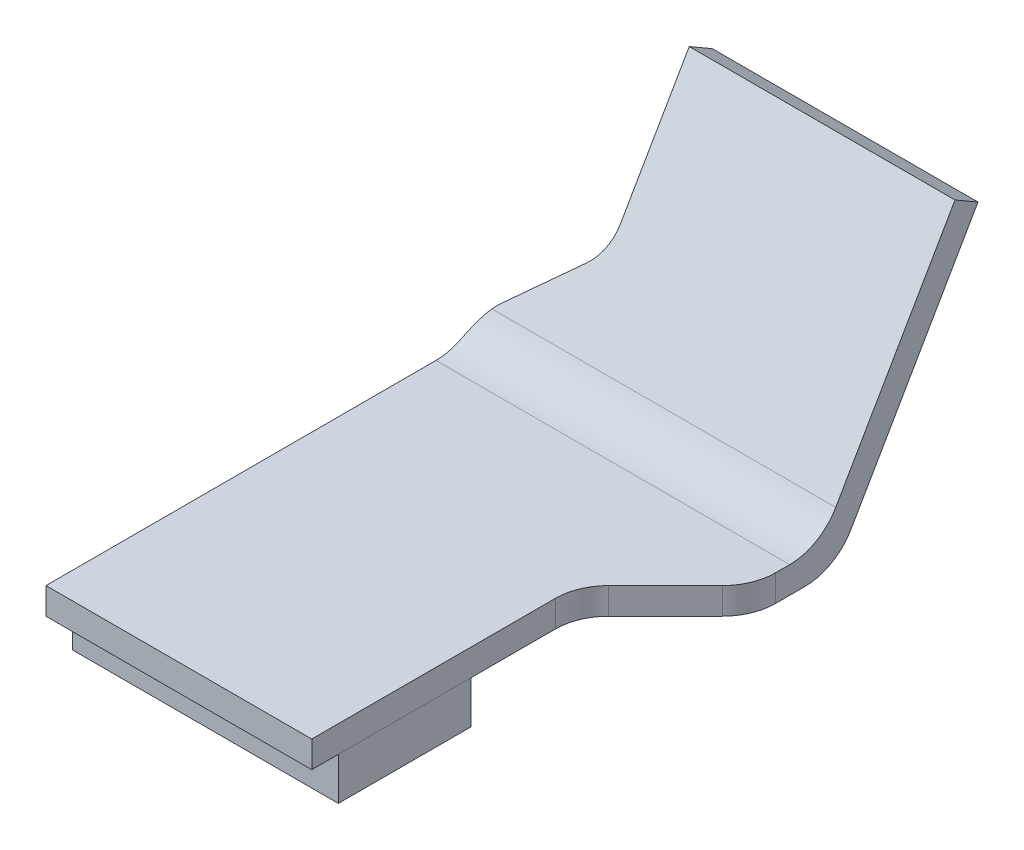
from build123d import *

# Parameters (mm, degrees)
BOSS_EXTRUDE1_DEPTH = 13.31
CUT_EXTRUDE1_DEPTH  = 1
CUT_EXTRUDE2_DEPTH  = 1
FILLET1_R           = 2
FILLET2_R           = 2
SKETCH4_W           = 10
SKETCH4_H           = 5
BOSS_EXTRUDE2_DEPTH = 1.6


with BuildPart() as part:
    # Sketch1 → Boss-Extrude1 (new body)
    with BuildSketch(Plane(origin=(0, 0, 0), x_dir=(0, 0, -1), z_dir=(1, 0, 0))):
        Polygon((4.487924596, 9.773313421), (-0.577350269, 1), (-16.4065524, 1), (-16.4065524, 0), (0, 0), (5.35395, 9.273313421), align=None)
    extrude(amount=BOSS_EXTRUDE1_DEPTH)

    # Sketch2 → Cut-Extrude1 (cut)
    with BuildSketch(Plane(origin=(0, 0, 0), x_dir=(1, 0, 0), z_dir=(0, 1, 0))):
        Polygon((13.31, -16.4065524), (10, -16.4065524), (10, -6.4065524), (13.31, -3.0965524), align=None)
    extrude(amount=CUT_EXTRUDE1_DEPTH, mode=Mode.SUBTRACT)

    # Sketch3 → Cut-Extrude2 (cut)
    with BuildSketch(Plane(origin=(0, 0.49999999999999784, 0.8660254037844414), x_dir=(1, 0, 0), z_dir=(0, 0.49999999999999734, 0.8660254037844402))):
        Polygon((0, 10.7079), (0, 1.3979), (3.31, 4.7079), (3.31, 10.7079), align=None)
    extrude(amount=-CUT_EXTRUDE2_DEPTH, mode=Mode.SUBTRACT)

    # Fillet1
    fillet1_edges = [part.edges().sort_by_distance(p)[0] for p in [
        (6.655, 1, 0.577350269),
        (6.655, 0, 0),
    ]]
    fillet(fillet1_edges, radius=FILLET1_R)

    # Fillet2
    fillet2_edges = [part.edges().sort_by_distance(p)[0] for p in [
        (3.31, 4.327160998, -1.920937298),
        (0, 1.467644852, -0.25376455),
        (10, 0.5, 6.4065524),
        (13.31, 0.5, 3.0965524),
    ]]
    fillet(fillet2_edges, radius=FILLET2_R)


with BuildPart() as body_2:
    # Sketch4 → Boss-Extrude2 (new body)
    with BuildSketch(Plane.XZ):
        with Locations((5, 12.9065524)):
            Rectangle(SKETCH4_W, SKETCH4_H)
    extrude(amount=BOSS_EXTRUDE2_DEPTH)


solid = Compound([part.part, body_2.part])
